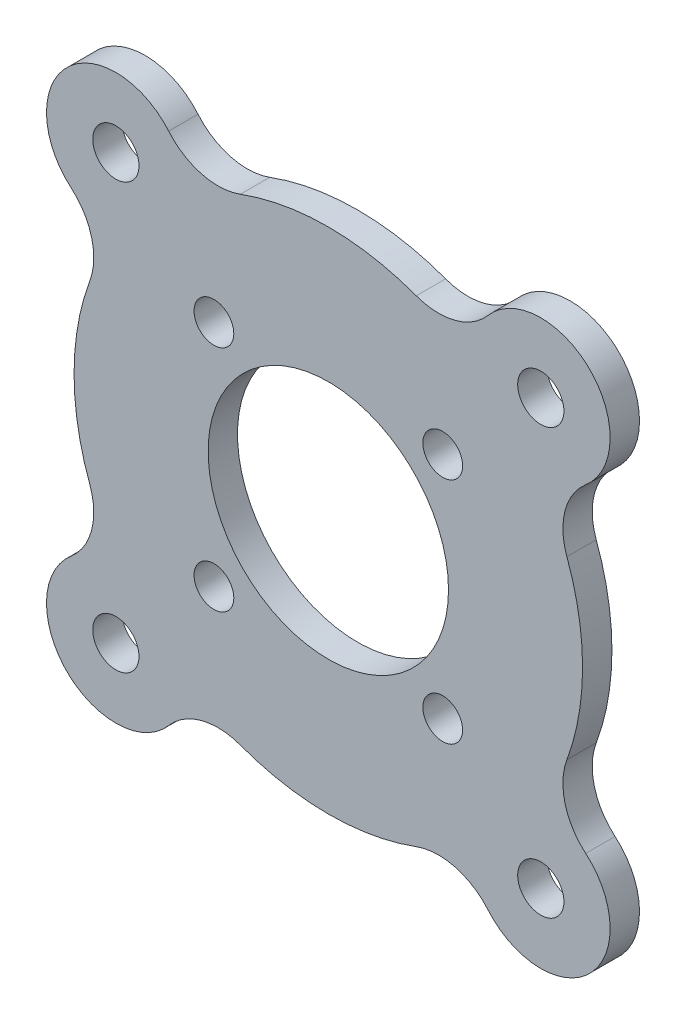
from build123d import *

# Parameters (mm, degrees)
SKETCH1_R                             = 7.5
SKETCH1_R_2                           = 27.5
F_125_IN_SHEET_DEPTH                  = 1.5875
FILLET1_R                             = 7
SKETCH2_R                             = 13
CUT_EXTRUDE1_DEPTH                    = 44.223370409
M4_CLEARANCE_HOLE1_D                  = 4.3
F_5_0_REAMED_OVER_FOR_SHOULDER_BOLT_D = 5


with BuildPart() as part:
    # Sketch1 → .125 in sheet (new, symmetric)
    with BuildSketch(Plane.XY):
        with Locations((22.980970389, 22.980970389)):
            Circle(SKETCH1_R)
        Circle(SKETCH1_R_2)
        with Locations((-22.980970389, 22.980970389)):
            Circle(SKETCH1_R)
        with Locations((-22.980970389, -22.980970389)):
            Circle(SKETCH1_R)
        with Locations((22.980970389, -22.980970389)):
            Circle(SKETCH1_R)
    extrude(amount=F_125_IN_SHEET_DEPTH, both=True)

    # Fillet1
    fillet1_edges = [part.edges().sort_by_distance(p)[0] for p in [
        (15.485317723, -22.725644876, 0),
        (-15.485317723, -22.725644876, 0),
        (-22.725644876, -15.485317723, 0),
        (-22.725644876, 15.485317723, 0),
        (-15.485317723, 22.725644876, 0),
        (15.485317723, 22.725644876, 0),
        (22.725644876, 15.485317723, 0),
        (22.725644876, -15.485317723, 0),
    ]]
    fillet(fillet1_edges, radius=FILLET1_R)

    # Sketch2 → Cut-Extrude1 (cut, through all)
    with BuildSketch(Plane.XY.offset(1.5875)):
        Circle(SKETCH2_R)
    extrude(amount=-CUT_EXTRUDE1_DEPTH, mode=Mode.SUBTRACT)

    # M4 Clearance Hole1 (through all)
    with Locations(Plane.XY.offset(1.5875)):
        with Locations((-12.374368671, 12.374368671), (12.374368671, 12.374368671), (12.374368671, -12.374368671), (-12.374368671, -12.374368671)):
            Hole(M4_CLEARANCE_HOLE1_D / 2)

    # Ø5.0 Reamed over for shoulder bolt (through all)
    with Locations(Plane.XY.offset(1.5875)):
        with Locations((-22.980970389, 22.980970389), (22.980970389, 22.980970389), (22.980970389, -22.980970389), (-22.980970389, -22.980970389)):
            Hole(F_5_0_REAMED_OVER_FOR_SHOULDER_BOLT_D / 2)


solid = part.part
